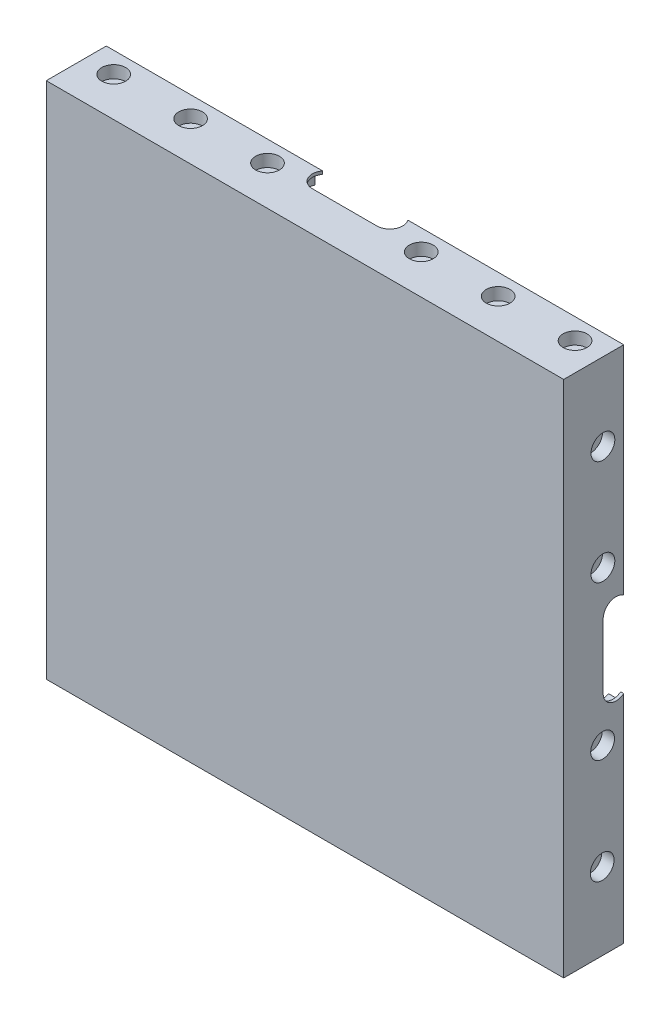
from build123d import *

# Parameters (mm, degrees)
BOSS_EXTRUDE1_START   = 0.4
BOSS_EXTRUDE1_DEPTH   = 3
BOSS_EXTRUDE1_2_DEPTH = 3
BOSS_EXTRUDE1_3_DEPTH = 3
BOSS_EXTRUDE1_4_DEPTH = 3
BOSS_EXTRUDE2_START   = 3.4
SKETCH1_3_W           = 2
SKETCH1_3_H           = 15.4
SKETCH1_3_W_2         = 15.4
SKETCH1_3_H_2         = 2
BOSS_EXTRUDE2_DEPTH   = 2.85
BOSS_EXTRUDE3_START   = 6.25
SKETCH1_4_W           = 122
SKETCH1_4_H           = 122
SKETCH1_4_W_2         = 2
SKETCH1_4_H_2         = 15.4
SKETCH1_4_W_3         = 15.4
SKETCH1_4_H_3         = 2
BOSS_EXTRUDE3_DEPTH   = 7.76706
BOSS_EXTRUDE4_DEPTH   = 3.85
BOSS_EXTRUDE6_DEPTH   = 3.45
BOSS_EXTRUDE9_START   = 3.55
BOSS_EXTRUDE9_DEPTH   = 3.55
BOSS_EXTRUDE10_START  = 3.55
BOSS_EXTRUDE10_DEPTH  = 3.55
BOSS_EXTRUDE11_DEPTH  = 0.8
BOSS_EXTRUDE12_DEPTH  = 0.8
BOSS_EXTRUDE13_START  = 0.8
BOSS_EXTRUDE13_DEPTH  = 0.8
BOSS_EXTRUDE14_START  = 0.8
BOSS_EXTRUDE14_DEPTH  = 0.8
SKETCH11_W            = 126.6
SKETCH11_H            = 126.6
CUT_EXTRUDE1_DEPTH    = 2
SKETCH12_R            = 1.8
CUT_EXTRUDE2_DEPTH    = 5
BOSS_EXTRUDE15_DEPTH  = 0.15
CUT_EXTRUDE3_START    = 0.8
SKETCH9_4_W           = 134.6
SKETCH9_4_H           = 15.61706
CUT_EXTRUDE3_DEPTH    = 0.15
SKETCH13_R            = 3.1
CUT_EXTRUDE4_DEPTH    = 3.2
CUT_EXTRUDE5_START    = -131.4
SKETCH13_2_R          = 3.1
CUT_EXTRUDE5_DEPTH    = 3.2
SKETCH14_R            = 3.1
CUT_EXTRUDE6_DEPTH    = 3.2
CUT_EXTRUDE7_START    = -131.65
SKETCH14_2_R          = 3.1
CUT_EXTRUDE7_DEPTH    = 3.2
SKETCH15_R            = 2.6
SKETCH15_R_2          = 1.8
BOSS_EXTRUDE17_DEPTH  = 5.85
FILLET1_R             = 4.5


with BuildPart() as part:
    # Sketch1 → Boss-Extrude1 (new body)
    with BuildSketch(Plane.XY.offset(BOSS_EXTRUDE1_START)):
        Polygon((-63, 63), (-63, 7.7), (-61, 7.7), (-61, 61), (-7.7, 61), (-7.7, 63), align=None)
    extrude(amount=BOSS_EXTRUDE1_DEPTH)



with BuildPart() as body_2:
    # Sketch1 → Boss-Extrude1 2 (new body)
    with BuildSketch(Plane.XY.offset(BOSS_EXTRUDE1_START)):
        Polygon((-63, -7.7), (-63, -63), (-7.7, -63), (-7.7, -61), (-61, -61), (-61, -7.7), align=None)
    extrude(amount=BOSS_EXTRUDE1_2_DEPTH)


with BuildPart() as body_3:
    # Sketch1 → Boss-Extrude1 3 (new body)
    with BuildSketch(Plane.XY.offset(BOSS_EXTRUDE1_START)):
        Polygon((7.7, -61), (7.7, -63), (63, -63), (63, -7.7), (61, -7.7), (61, -61), align=None)
    extrude(amount=BOSS_EXTRUDE1_3_DEPTH)


with BuildPart() as body_4:
    # Sketch1 → Boss-Extrude1 4 (new body)
    with BuildSketch(Plane.XY.offset(BOSS_EXTRUDE1_START)):
        Polygon((61, 7.7), (63, 7.7), (63, 63), (7.7, 63), (7.7, 61), (61, 61), align=None)
    extrude(amount=BOSS_EXTRUDE1_4_DEPTH)


with BuildPart() as part_1:
    add(part.part)

    add(body_2.part)  # Boss-Extrude2 merges body 2

    add(body_3.part)  # Boss-Extrude2 merges body 3

    add(body_4.part)  # Boss-Extrude2 merges body 4
    # Sketch1<3> → Boss-Extrude2 (add)
    with BuildSketch(Plane.XY.offset(BOSS_EXTRUDE2_START)):
        with Locations((-62, 0)):
            Rectangle(SKETCH1_3_W, SKETCH1_3_H)
        Polygon((-63, 63), (-63, 7.7), (-61, 7.7), (-61, 61), (-7.7, 61), (-7.7, 63), align=None)
        Polygon((-63, -7.7), (-63, -63), (-7.7, -63), (-7.7, -61), (-61, -61), (-61, -7.7), align=None)
        Polygon((7.7, -61), (7.7, -63), (63, -63), (63, -7.7), (61, -7.7), (61, -61), align=None)
        Polygon((61, 7.7), (63, 7.7), (63, 63), (7.7, 63), (7.7, 61), (61, 61), align=None)
        with Locations((62, 0)):
            Rectangle(SKETCH1_3_W, SKETCH1_3_H)
        with Locations((0, -62)):
            Rectangle(SKETCH1_3_W_2, SKETCH1_3_H_2)
        with Locations((0, 62)):
            Rectangle(SKETCH1_3_W_2, SKETCH1_3_H_2)
    extrude(amount=BOSS_EXTRUDE2_DEPTH)

    # Sketch1<4> → Boss-Extrude3 (add)
    with BuildSketch(Plane.XY.offset(BOSS_EXTRUDE3_START)):
        Rectangle(SKETCH1_4_W, SKETCH1_4_H)
        with Locations((-62, 0)):
            Rectangle(SKETCH1_4_W_2, SKETCH1_4_H_2)
        Polygon((-63, 63), (-63, 7.7), (-61, 7.7), (-61, 61), (-7.7, 61), (-7.7, 63), align=None)
        Polygon((-63, -7.7), (-63, -63), (-7.7, -63), (-7.7, -61), (-61, -61), (-61, -7.7), align=None)
        with Locations((0, -62)):
            Rectangle(SKETCH1_4_W_3, SKETCH1_4_H_3)
        Polygon((7.7, -61), (7.7, -63), (63, -63), (63, -7.7), (61, -7.7), (61, -61), align=None)
        with Locations((62, 0)):
            Rectangle(SKETCH1_4_W_2, SKETCH1_4_H_2)
        Polygon((61, 7.7), (63, 7.7), (63, 63), (7.7, 63), (7.7, 61), (61, 61), align=None)
        with Locations((0, 62)):
            Rectangle(SKETCH1_4_W_3, SKETCH1_4_H_3)
    extrude(amount=BOSS_EXTRUDE3_DEPTH)

    # Sketch2 → Boss-Extrude4 (add)
    with BuildSketch(Plane(origin=(0, 63, 0), x_dir=(1, 0, 0), z_dir=(0, 1, 0))):
        with BuildLine():
            ThreePointArc((-8.5, -5.4), (-12.683300133, -3.138612788), (-13.082575695, 1.6))
            Line((-13.082575695, 1.6), (-63, 1.6))
            Line((-63, 1.6), (-63, -14.01706))
            Line((-63, -14.01706), (63, -14.01706))
            Line((63, -14.01706), (63, 1.6))
            Line((63, 1.6), (13.082575695, 1.6))
            ThreePointArc((13.082575695, 1.6), (12.683300133, -3.138612788), (8.5, -5.4))
            Line((8.5, -5.4), (-8.5, -5.4))
        make_face()
    extrude(amount=BOSS_EXTRUDE4_DEPTH)

    # Sketch3 → Boss-Extrude6 (add)
    with BuildSketch(Plane(origin=(63, 0, 0), x_dir=(0, 0, -1), z_dir=(1, 0, 0))):
        with BuildLine():
            ThreePointArc((-5.4, 8.5), (-3.138612788, 12.683300133), (1.6, 13.082575695))
            Line((1.6, 13.082575695), (1.6, 66.85))
            Line((1.6, 66.85), (-14.01706, 66.85))
            Line((-14.01706, 66.85), (-14.01706, -63))
            Line((-14.01706, -63), (1.6, -63))
            Line((1.6, -63), (1.6, -13.082575695))
            ThreePointArc((1.6, -13.082575695), (-3.138612788, -12.683300133), (-5.4, -8.5))
            Line((-5.4, -8.5), (-5.4, 8.5))
        make_face()
    extrude(amount=BOSS_EXTRUDE6_DEPTH)

    # Sketch4 → Boss-Extrude9 (add)
    with BuildSketch(Plane.XZ.offset(63).offset(BOSS_EXTRUDE9_START)):
        with BuildLine():
            ThreePointArc((8.5, 5.4), (12.683300133, 3.138612788), (13.082575695, -1.6))
            Line((13.082575695, -1.6), (66.45, -1.6))
            Line((66.45, -1.6), (66.45, 14.01706))
            Line((66.45, 14.01706), (-63, 14.01706))
            Line((-63, 14.01706), (-63, -1.6))
            Line((-63, -1.6), (-13.082575695, -1.6))
            ThreePointArc((-13.082575695, -1.6), (-12.683300133, 3.138612788), (-8.5, 5.4))
            Line((-8.5, 5.4), (8.5, 5.4))
        make_face()
    extrude(amount=-BOSS_EXTRUDE9_DEPTH)

    # Sketch5 → Boss-Extrude10 (add)
    with BuildSketch(Plane.ZY.offset(63).offset(BOSS_EXTRUDE10_START)):
        with BuildLine():
            ThreePointArc((5.4, -8.5), (3.138612788, -12.683300133), (-1.6, -13.082575695))
            Line((-1.6, -13.082575695), (-1.6, -66.55))
            Line((-1.6, -66.55), (14.01706, -66.55))
            Line((14.01706, -66.55), (14.01706, 66.85))
            Line((14.01706, 66.85), (-1.6, 66.85))
            Line((-1.6, 66.85), (-1.6, 13.082575695))
            ThreePointArc((-1.6, 13.082575695), (3.138612788, 12.683300133), (5.4, 8.5))
            Line((5.4, 8.5), (5.4, -8.5))
        make_face()
    extrude(amount=-BOSS_EXTRUDE10_DEPTH)

    # Sketch6 → Boss-Extrude11 (add)
    with BuildSketch(Plane.ZY.offset(66.55)):
        with BuildLine():
            ThreePointArc((3.75, -8.4), (1.903745324, -11.3935347), (-1.6, -11.08747093))
            Line((-1.6, -11.08747093), (-1.6, -66.55))
            Line((-1.6, -66.55), (14.01706, -66.55))
            Line((14.01706, -66.55), (14.01706, 66.85))
            Line((14.01706, 66.85), (-1.6, 66.85))
            Line((-1.6, 66.85), (-1.6, 11.08747093))
            ThreePointArc((-1.6, 11.08747093), (1.903745324, 11.3935347), (3.75, 8.4))
            Line((3.75, 8.4), (3.75, -8.4))
        make_face()
    extrude(amount=BOSS_EXTRUDE11_DEPTH)

    # Sketch7 → Boss-Extrude12 (add)
    with BuildSketch(Plane.XZ.offset(66.55)):
        with BuildLine():
            ThreePointArc((8.4, 3.75), (11.3935347, 1.903745324), (11.08747093, -1.6))
            Line((11.08747093, -1.6), (66.45, -1.6))
            Line((66.45, -1.6), (66.45, 14.01706))
            Line((66.45, 14.01706), (-67.35, 14.01706))
            Line((-67.35, 14.01706), (-67.35, -1.6))
            Line((-67.35, -1.6), (-11.08747093, -1.6))
            ThreePointArc((-11.08747093, -1.6), (-11.3935347, 1.903745324), (-8.4, 3.75))
            Line((-8.4, 3.75), (8.4, 3.75))
        make_face()
    extrude(amount=BOSS_EXTRUDE12_DEPTH)

    # Sketch8 → Boss-Extrude13 (add)
    with BuildSketch(Plane(origin=(66.45, 0, 0), x_dir=(0, 0, -1), z_dir=(1, 0, 0)).offset(BOSS_EXTRUDE13_START)):
        with BuildLine():
            Line((1.6, 11.08747093), (1.6, 66.85))
            Line((1.6, 66.85), (-14.01706, 66.85))
            Line((-14.01706, 66.85), (-14.01706, -67.35))
            Line((-14.01706, -67.35), (1.6, -67.35))
            Line((1.6, -67.35), (1.6, -11.08747093))
            ThreePointArc((1.6, -11.08747093), (-1.903745324, -11.3935347), (-3.75, -8.4))
            Line((-3.75, -8.4), (-3.75, 8.4))
            ThreePointArc((-3.75, 8.4), (-1.903745324, 11.3935347), (1.6, 11.08747093))
        make_face()
    extrude(amount=-BOSS_EXTRUDE13_DEPTH)

    # Sketch9 → Boss-Extrude14 (add)
    with BuildSketch(Plane(origin=(0, 66.85, 0), x_dir=(1, 0, 0), z_dir=(0, 1, 0)).offset(BOSS_EXTRUDE14_START)):
        with BuildLine():
            ThreePointArc((-8.4, -3.75), (-11.3935347, -1.903745324), (-11.08747093, 1.6))
            Line((-11.08747093, 1.6), (-67.35, 1.6))
            Line((-67.35, 1.6), (-67.35, -14.01706))
            Line((-67.35, -14.01706), (67.25, -14.01706))
            Line((67.25, -14.01706), (67.25, 1.6))
            Line((67.25, 1.6), (11.08747093, 1.6))
            ThreePointArc((11.08747093, 1.6), (11.3935347, -1.903745324), (8.4, -3.75))
            Line((8.4, -3.75), (-8.4, -3.75))
        make_face()
    extrude(amount=-BOSS_EXTRUDE14_DEPTH)

    # Sketch11 → Cut-Extrude1 (cut)
    with BuildSketch(Plane(origin=(0, 0, -1.6), x_dir=(-1, 0, 0), z_dir=(0, 0, -1))):
        Rectangle(SKETCH11_W, SKETCH11_H)
    extrude(amount=-CUT_EXTRUDE1_DEPTH, mode=Mode.SUBTRACT)

    # Sketch12 → Cut-Extrude2 (cut)
    with BuildSketch(Plane(origin=(0, 0, -1.6), x_dir=(-1, 0, 0), z_dir=(0, 0, -1))):
        with Locations((-64.913397924, 65.076779992)):
            Circle(SKETCH12_R)
        with Locations((-64.975712162, -65.018135254)):
            Circle(SKETCH12_R)
        with Locations((64.997056275, -64.997056275)):
            Circle(SKETCH12_R)
        with Locations((64.935404467, 65.056545539)):
            Circle(SKETCH12_R)
    extrude(amount=-CUT_EXTRUDE2_DEPTH, mode=Mode.SUBTRACT)

    # Sketch9<3> → Boss-Extrude15 (add)
    with BuildSketch(Plane(origin=(0, 66.85, 0), x_dir=(1, 0, 0), z_dir=(0, 1, 0))):
        with BuildLine():
            ThreePointArc((-8.4, -3.75), (-11.3935347, -1.903745324), (-11.08747093, 1.6))
            Line((-11.08747093, 1.6), (-13.082575695, 1.6))
            ThreePointArc((-13.082575695, 1.6), (-12.683300133, -3.138612788), (-8.5, -5.4))
            Line((-8.5, -5.4), (8.5, -5.4))
            ThreePointArc((8.5, -5.4), (12.683300133, -3.138612788), (13.082575695, 1.6))
            Line((13.082575695, 1.6), (11.08747093, 1.6))
            ThreePointArc((11.08747093, 1.6), (11.3935347, -1.903745324), (8.4, -3.75))
            Line((8.4, -3.75), (-8.4, -3.75))
        make_face()
    extrude(amount=-BOSS_EXTRUDE15_DEPTH)

    # Sketch9<4> → Cut-Extrude3 (cut)
    with BuildSketch(Plane(origin=(0, 66.85, 0), x_dir=(1, 0, 0), z_dir=(0, 1, 0)).offset(CUT_EXTRUDE3_START)):
        with Locations((-0.05, -6.20853)):
            Rectangle(SKETCH9_4_W, SKETCH9_4_H)
    extrude(amount=-CUT_EXTRUDE3_DEPTH, mode=Mode.SUBTRACT)

    # Sketch13 → Cut-Extrude4 (cut)
    with BuildSketch(Plane.ZY.offset(67.35)):
        with Locations((3.90028737, -19.99372739)):
            Circle(SKETCH13_R)
        with Locations((4.010924584, -47.284128126)):
            Circle(SKETCH13_R)
        with Locations((3.8192, 20.009375)):
            Circle(SKETCH13_R)
        with Locations((3.8192, 47.3)):
            Circle(SKETCH13_R)
    extrude(amount=-CUT_EXTRUDE4_DEPTH, mode=Mode.SUBTRACT)

    # Sketch13<2> → Cut-Extrude5 (cut)
    with BuildSketch(Plane.ZY.offset(67.35).offset(CUT_EXTRUDE5_START)):
        with Locations((3.90028737, -19.99372739)):
            Circle(SKETCH13_2_R)
        with Locations((4.010924584, -47.284128126)):
            Circle(SKETCH13_2_R)
        with Locations((3.8192, 20.009375)):
            Circle(SKETCH13_2_R)
        with Locations((3.8192, 47.3)):
            Circle(SKETCH13_2_R)
    extrude(amount=-CUT_EXTRUDE5_DEPTH, mode=Mode.SUBTRACT)

    # Sketch14 → Cut-Extrude6 (cut)
    with BuildSketch(Plane.XZ.offset(67.35)):
        with Locations(Location((-20, 3.8192, 0), (0, 0, 270))):
            Circle(SKETCH14_R)
        with Locations(Location((-60, 3.8192, 0), (0, 0, 270))):
            Circle(SKETCH14_R)
        with Locations(Location((60, 3.8192, 0), (0, 0, 90))):
            Circle(SKETCH14_R)
        with Locations(Location((-40, 3.8192, 0), (0, 0, 270))):
            Circle(SKETCH14_R)
        with Locations(Location((40, 3.8192, 0), (0, 0, 90))):
            Circle(SKETCH14_R)
        with Locations(Location((20, 3.8192, 0), (0, 0, 90))):
            Circle(SKETCH14_R)
    extrude(amount=-CUT_EXTRUDE6_DEPTH, mode=Mode.SUBTRACT)

    # Sketch14<2> → Cut-Extrude7 (cut)
    with BuildSketch(Plane.XZ.offset(67.35).offset(CUT_EXTRUDE7_START)):
        with Locations(Location((-20, 3.8192, 0), (0, 0, 270))):
            Circle(SKETCH14_2_R)
        with Locations(Location((-60, 3.8192, 0), (0, 0, 270))):
            Circle(SKETCH14_2_R)
        with Locations(Location((60, 3.8192, 0), (0, 0, 90))):
            Circle(SKETCH14_2_R)
        with Locations(Location((-40, 3.8192, 0), (0, 0, 270))):
            Circle(SKETCH14_2_R)
        with Locations(Location((40, 3.8192, 0), (0, 0, 90))):
            Circle(SKETCH14_2_R)
        with Locations(Location((20, 3.8192, 0), (0, 0, 90))):
            Circle(SKETCH14_2_R)
    extrude(amount=-CUT_EXTRUDE7_DEPTH, mode=Mode.SUBTRACT)

    # Sketch15 → Boss-Extrude17 (add)
    # profile 1 of 8: a face of its own
    with BuildSketch(Plane(origin=(0, 0, 6.25), x_dir=(-1, 0, 0), z_dir=(0, 0, -1))):
        with Locations((-52.2, 58.5)):
            Circle(SKETCH15_R)
        with Locations(Location((-52.2, 58.5, 0), (0, 0, 180))):
            Circle(SKETCH15_R_2, mode=Mode.SUBTRACT)
    # profile 2 of 8: a face of its own
    with BuildSketch(Plane(origin=(0, 0, 6.25), x_dir=(-1, 0, 0), z_dir=(0, 0, -1))):
        with Locations(Location((-52.2, 34.7, 0), (0, 0, 180))):
            Circle(SKETCH15_R)
        with Locations(Location((-52.2, 34.7, 0), (0, 0, 180))):
            Circle(SKETCH15_R_2, mode=Mode.SUBTRACT)
    # profile 3 of 8: a face of its own
    with BuildSketch(Plane(origin=(0, 0, 6.25), x_dir=(-1, 0, 0), z_dir=(0, 0, -1))):
        with Locations(Location((-28.8, 34.7, 0), (0, 0, 180))):
            Circle(SKETCH15_R)
        with Locations(Location((-28.8, 34.7, 0), (0, 0, 180))):
            Circle(SKETCH15_R_2, mode=Mode.SUBTRACT)
    # profile 4 of 8: a face of its own
    with BuildSketch(Plane(origin=(0, 0, 6.25), x_dir=(-1, 0, 0), z_dir=(0, 0, -1))):
        with Locations(Location((-14.2, 34.7, 0), (0, 0, 180))):
            Circle(SKETCH15_R)
        with Locations(Location((-14.2, 34.7, 0), (0, 0, 180))):
            Circle(SKETCH15_R_2, mode=Mode.SUBTRACT)
    # profile 5 of 8: a face of its own
    with BuildSketch(Plane(origin=(0, 0, 6.25), x_dir=(-1, 0, 0), z_dir=(0, 0, -1))):
        with Locations(Location((9.2, 34.7, 0), (0, 0, 180))):
            Circle(SKETCH15_R)
        with Locations(Location((9.2, 34.7, 0), (0, 0, 180))):
            Circle(SKETCH15_R_2, mode=Mode.SUBTRACT)
    # profile 6 of 8: a face of its own
    with BuildSketch(Plane(origin=(0, 0, 6.25), x_dir=(-1, 0, 0), z_dir=(0, 0, -1))):
        with Locations((9.2, 58.5)):
            Circle(SKETCH15_R)
        with Locations(Location((9.2, 58.5, 0), (0, 0, 180))):
            Circle(SKETCH15_R_2, mode=Mode.SUBTRACT)
    # profile 7 of 8: a face of its own
    with BuildSketch(Plane(origin=(0, 0, 6.25), x_dir=(-1, 0, 0), z_dir=(0, 0, -1))):
        with Locations((-14.2, 58.5)):
            Circle(SKETCH15_R)
        with Locations(Location((-14.2, 58.5, 0), (0, 0, 180))):
            Circle(SKETCH15_R_2, mode=Mode.SUBTRACT)
    # profile 8 of 8: a face of its own
    with BuildSketch(Plane(origin=(0, 0, 6.25), x_dir=(-1, 0, 0), z_dir=(0, 0, -1))):
        with Locations((-28.8, 58.5)):
            Circle(SKETCH15_R)
        with Locations(Location((-28.8, 58.5, 0), (0, 0, 180))):
            Circle(SKETCH15_R_2, mode=Mode.SUBTRACT)
    extrude(amount=BOSS_EXTRUDE17_DEPTH)

    # Fillet1
    fillet1_edges = [part_1.edges().sort_by_distance(p)[0] for p in [
        (49.6, 34.7, 6.25),
        (52.2, 55.9, 6.25),
        (26.2, 34.7, 6.25),
        (11.6, 34.7, 6.25),
        (-11.8, 34.7, 6.25),
        (-9.2, 55.9, 6.25),
        (14.2, 55.9, 6.25),
        (28.8, 55.9, 6.25),
    ]]
    fillet(fillet1_edges, radius=FILLET1_R)


solid = part_1.part
